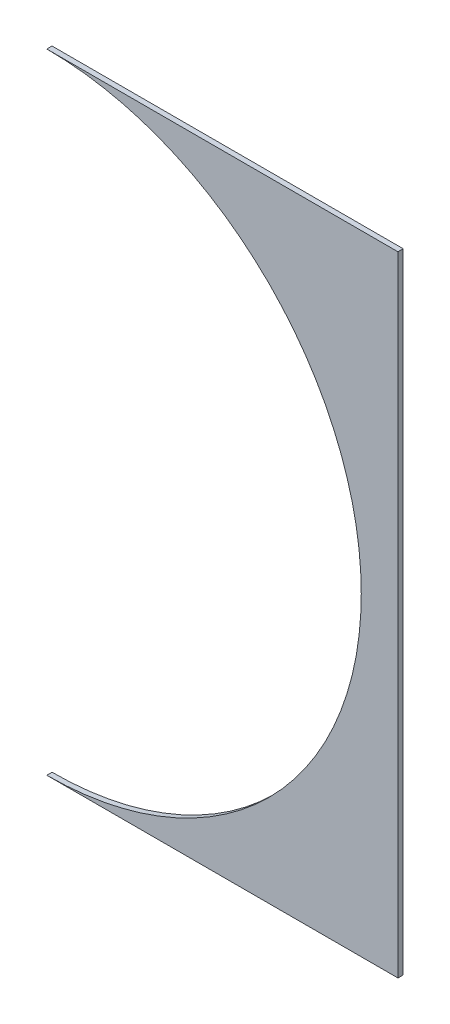
from build123d import *

# Parameters (mm, degrees)
BOSS_EXTRUDE1_DEPTH = 3.175


with BuildPart() as part:
    # Sketch1 → Boss-Extrude1 (new body)
    with BuildSketch(Plane.XY):
        with BuildLine():
            ThreePointArc((0, 0), (190.5, 190.5), (0, 381))
            Line((0, 381), (212.725, 381))
            Line((212.725, 381), (212.725, 0))
            Line((212.725, 0), (0, 0))
        make_face()
    extrude(amount=BOSS_EXTRUDE1_DEPTH)


solid = part.part
